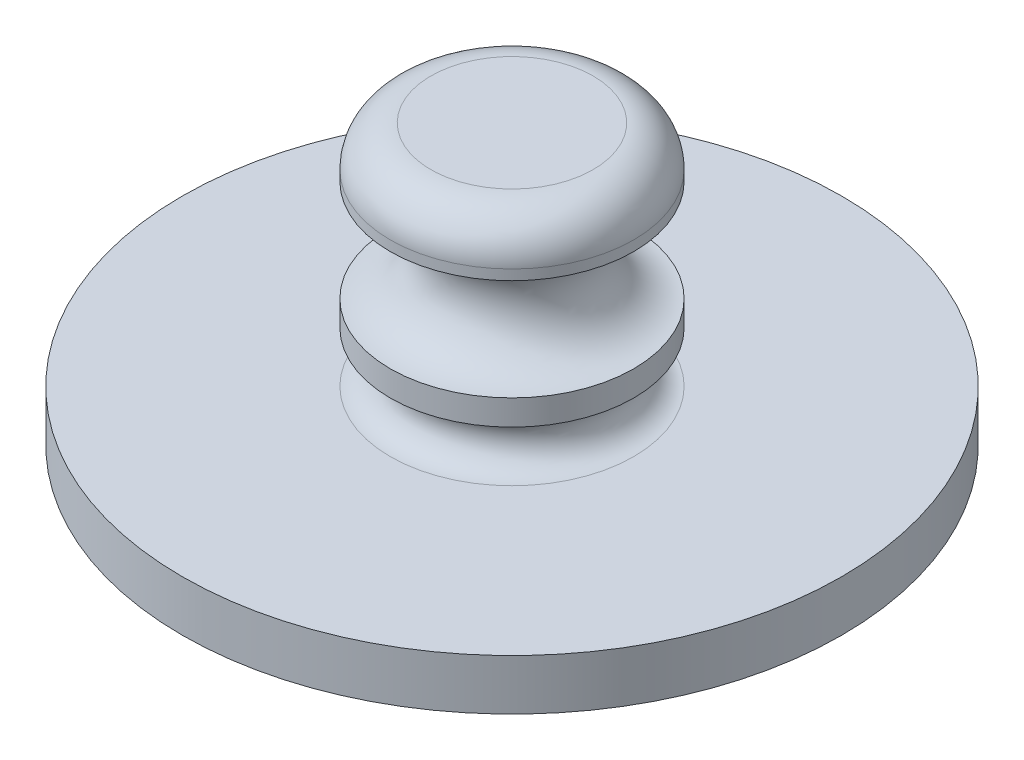
from build123d import *


with BuildPart() as part:
    # Sketch1 → Revolve1 (revolve)
    with BuildSketch(Plane.XY, mode=Mode.PRIVATE) as revolve1_sk:
        with BuildLine():
            Line((0, 1), (0, 0))
            Line((0, 0), (6.5, 0))
            Line((6.5, 0), (6.5, 1))
            Line((6.5, 1), (2.4, 1))
            ThreePointArc((2.4, 1), (1.9, 1.5), (2.4, 2))
            Line((2.4, 2), (2.4, 2.5))
            ThreePointArc((2.4, 2.5), (1.4, 3.5), (2.4, 4.5))
            Line((2.4, 4.5), (2.4, 4.7))
            ThreePointArc((2.4, 4.7), (2.165685425, 5.265685425), (1.6, 5.5))
            Line((1.6, 5.5), (0, 5.5))
            Line((0, 5.5), (0, 1))
        make_face()
    revolve(revolve1_sk.sketch.rotate(Axis((0, 0, 0), (0, 1, 0)), 90), axis=Axis((0, 0, 0), (0, 1, 0)))


solid = part.part
